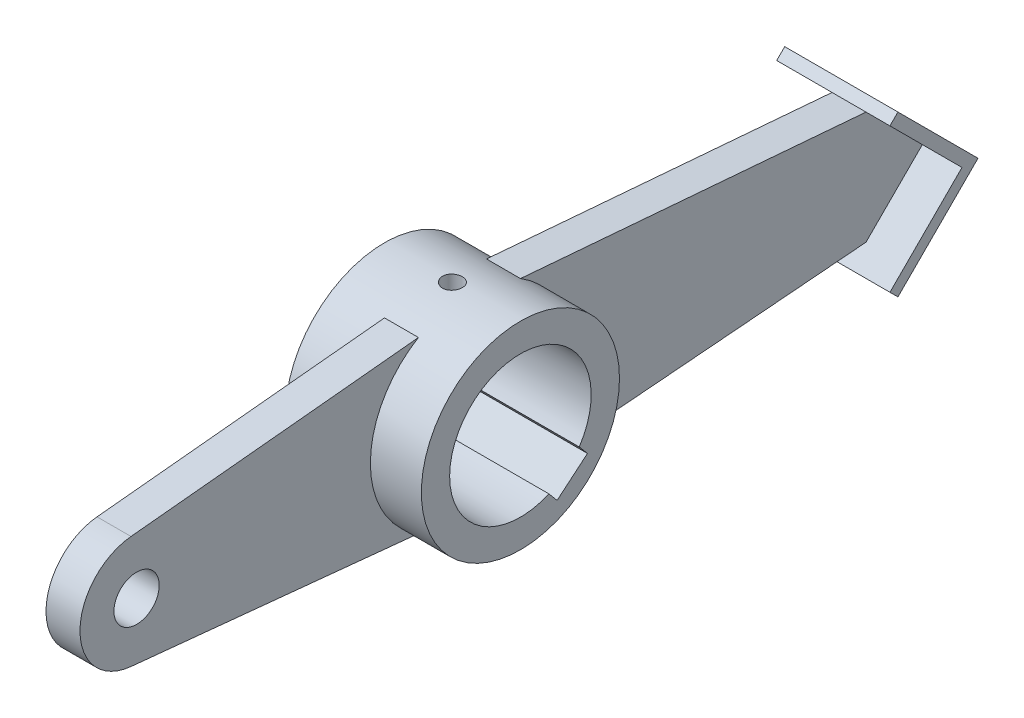
from build123d import *

# Parameters (mm, degrees)
SKETCH1_R           = 35
SKETCH1_R_2         = 25
BOSS_EXTRUDE1_DEPTH = 24
BOSS_EXTRUDE2_DEPTH = 6
SKETCH3_R           = 8
CUT_EXTRUDE1_DEPTH  = 15
CUT_EXTRUDE2_DEPTH  = 171.672200431
SKETCH6_R           = 3.5
CUT_EXTRUDE3_DEPTH  = 24
BOSS_EXTRUDE4_DEPTH = 20


with BuildPart() as part:
    # Sketch1 → Boss-Extrude1 (new, symmetric)
    with BuildSketch(Plane(origin=(0, 0, 0), x_dir=(0, 0, -1), z_dir=(1, 0, 0))):
        Circle(SKETCH1_R)
        Circle(SKETCH1_R_2, mode=Mode.SUBTRACT)
    extrude(amount=BOSS_EXTRUDE1_DEPTH, both=True)

    # Sketch2 → Boss-Extrude2 (add, symmetric)
    with BuildSketch(Plane(origin=(0, 0, 0), x_dir=(0, 0, -1), z_dir=(1, 0, 0))):
        with BuildLine():
            ThreePointArc((-18.027756377, -30), (-35, 0), (-18.027756377, 30))
            Line((-18.027756377, 30), (-119.579019246, 19.901846216))
            ThreePointArc((-119.579019246, 19.901846216), (-137.6, 0), (-119.579019246, -19.901846216))
            Line((-119.579019246, -19.901846216), (-18.027756377, -30))
        make_face()
        with BuildLine():
            Line((140.098153784, 19.901846216), (18.027756377, 30))
            ThreePointArc((18.027756377, 30), (35, 0), (18.027756377, -30))
            Line((18.027756377, -30), (140.098153784, -19.901846216))
            Line((140.098153784, -19.901846216), (160, 0))
            Line((160, 0), (140.098153784, 19.901846216))
        make_face()
    extrude(amount=BOSS_EXTRUDE2_DEPTH, both=True)

    # Sketch3 → Cut-Extrude1 (cut)
    with BuildSketch(Plane(origin=(6, 0, 0), x_dir=(0, 0, -1), z_dir=(1, 0, 0))):
        with Locations((-117.6, 0)):
            Circle(SKETCH3_R)
    extrude(amount=-CUT_EXTRUDE1_DEPTH, mode=Mode.SUBTRACT)

    # Sketch5 → Cut-Extrude2 (cut, through all)
    with BuildSketch(Plane(origin=(24, 0, 0), x_dir=(0, 0, -1), z_dir=(1, 0, 0))):
        Polygon((23.681757978, -17.332753361), (12.957135774, -26.331779897), (3.997953594, -15.654642346), (14.722575797, -6.655615811), align=None)
    extrude(amount=-CUT_EXTRUDE2_DEPTH, mode=Mode.SUBTRACT)

    # Sketch6 → Cut-Extrude3 (cut)
    with BuildSketch(Plane(origin=(0, 35, 0), x_dir=(-1, 0, 0), z_dir=(0, 1, 0))):
        with Locations(Location((0, 0, 0), (0, 0, 90))):
            Circle(SKETCH6_R)
    extrude(amount=-CUT_EXTRUDE3_DEPTH, mode=Mode.SUBTRACT)


with BuildPart() as body_2:
    # Sketch11 → Boss-Extrude4 (new, symmetric)
    with BuildSketch(Plane(origin=(0, 0, 0), x_dir=(0, 0, -1), z_dir=(1, 0, 0))):
        Polygon((134.544155877, -25.455844123), (160, 0), (134.544155877, 25.455844123), (137.372583002, 28.284271247), (165.656854249, 0), (137.372583002, -28.284271247), align=None)
    extrude(amount=BOSS_EXTRUDE4_DEPTH, both=True)


solid = Compound([part.part, body_2.part])
